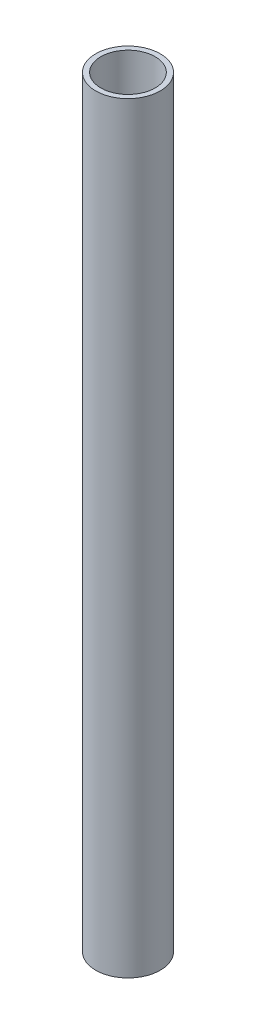
from build123d import *

# Parameters (mm, degrees)
SKETCH1_R           = 12.7
SKETCH1_R_2         = 10.7
BOSS_EXTRUDE1_DEPTH = 300


with BuildPart() as part:
    # Sketch1 → Boss-Extrude1 (new body)
    with BuildSketch(Plane(origin=(0, 0, 0), x_dir=(1, 0, 0), z_dir=(0, 1, 0))):
        with Locations(Location((0, 0, 0), (0, 0, 270))):
            Circle(SKETCH1_R)
        with Locations(Location((0, 0, 0), (0, 0, 270))):
            Circle(SKETCH1_R_2, mode=Mode.SUBTRACT)
    extrude(amount=BOSS_EXTRUDE1_DEPTH)


solid = part.part
